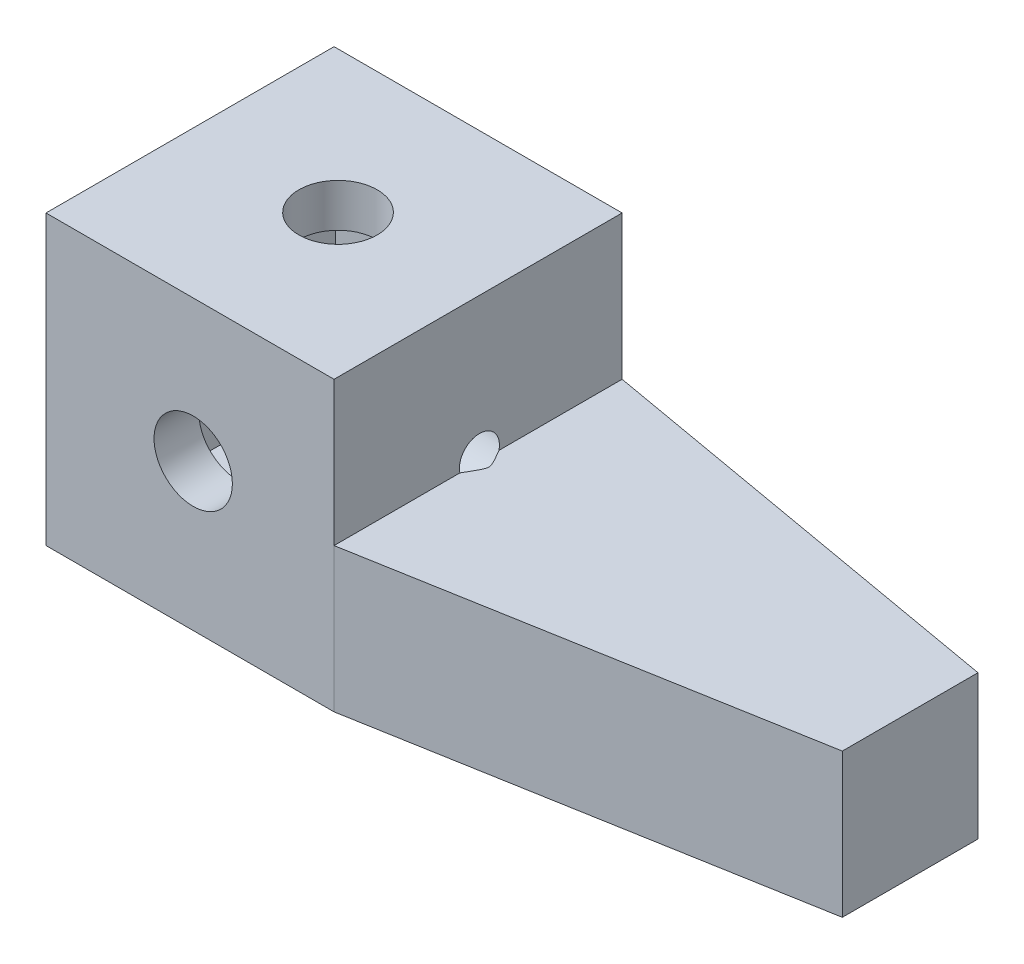
from build123d import *

# Parameters (mm, degrees)
BOSS_EXTRUDE1_DEPTH       = 6.35
SKETCH2_W                 = 12.7
SKETCH2_H                 = 12.7
BOSS_EXTRUDE2_DEPTH       = 12.7
CUT_EXTRUDE1_DEPTH        = 4.445
CUT_EXTRUDE1_DEPTH_BACK   = 4.445
CUT_EXTRUDE1_START        = 6.35
SKETCH3_W                 = 8.89
SKETCH3_H                 = 8.89
F_8_32_TAPPED_HOLE1_D     = 3.4544
F_8_32_TAPPED_HOLE1_DEPTH = 12.28344
F_8_32_TAPPED_HOLE1_TIP   = 1.037806461
F_8_32_TAPPED_HOLE2_D     = 3.4544
F_8_32_TAPPED_HOLE2_DEPTH = 12.192
F_8_32_TAPPED_HOLE2_TIP   = 1.037806461
F_8_32_TAPPED_HOLE3_D     = 3.4544
F_8_32_TAPPED_HOLE3_DEPTH = 12.192
F_8_32_TAPPED_HOLE3_TIP   = 1.037806461
F_8_32_TAPPED_HOLE4_D     = 3.4544
F_8_32_TAPPED_HOLE4_DEPTH = 12.192
F_8_32_TAPPED_HOLE4_TIP   = 1.037806461


with BuildPart() as part:
    # Sketch1 → Boss-Extrude1 (new body)
    with BuildSketch(Plane(origin=(0, 0, 0), x_dir=(1, 0, 0), z_dir=(0, 1, 0))):
        Polygon((0, 0), (19.05, 3.359028982), (19.05, 9.340971018), (0, 12.7), align=None)
    extrude(amount=BOSS_EXTRUDE1_DEPTH)

    # Sketch2 → Boss-Extrude2 (add)
    with BuildSketch(Plane(origin=(0, 0, 0), x_dir=(1, 0, 0), z_dir=(0, 1, 0))):
        with Locations((-6.35, 6.35)):
            Rectangle(SKETCH2_W, SKETCH2_H)
    extrude(amount=BOSS_EXTRUDE2_DEPTH)

    # Sketch3 → Cut-Extrude1 (cut, two sides: drawn at the far end of the back side and taken through both)
    with BuildSketch(Plane(origin=(0, 0, 0), x_dir=(1, 0, 0), z_dir=(0, 1, 0)).offset(CUT_EXTRUDE1_START - CUT_EXTRUDE1_DEPTH_BACK)):
        with Locations((-6.35, 6.421317362)):
            Rectangle(SKETCH3_W, SKETCH3_H)
    extrude(amount=CUT_EXTRUDE1_DEPTH + CUT_EXTRUDE1_DEPTH_BACK, mode=Mode.SUBTRACT)

    # #8-32 Tapped Hole1
    with Locations(Plane.XY):
        with Locations((-6.210106544, 6.467962425), (-17.791429467, 4.563139576)):
            Hole(F_8_32_TAPPED_HOLE1_D / 2, depth=F_8_32_TAPPED_HOLE1_DEPTH)
            with Locations((0, 0, -(F_8_32_TAPPED_HOLE1_DEPTH + F_8_32_TAPPED_HOLE1_TIP / 2))):  # 118° drill point
                Cone(0, F_8_32_TAPPED_HOLE1_D / 2, F_8_32_TAPPED_HOLE1_TIP, mode=Mode.SUBTRACT)

    # #8-32 Tapped Hole2
    with Locations(Plane(origin=(0, 0, -12.7), x_dir=(-1, 0, 0), z_dir=(0, 0, -1))):
        with Locations((6.210106544, 6.467962425)):
            Hole(F_8_32_TAPPED_HOLE2_D / 2, depth=F_8_32_TAPPED_HOLE2_DEPTH)
            with Locations((0, 0, -(F_8_32_TAPPED_HOLE2_DEPTH + F_8_32_TAPPED_HOLE2_TIP / 2))):  # 118° drill point
                Cone(0, F_8_32_TAPPED_HOLE2_D / 2, F_8_32_TAPPED_HOLE2_TIP, mode=Mode.SUBTRACT)

    # #8-32 Tapped Hole3
    with Locations(Plane(origin=(0, 12.7, 0), x_dir=(1, 0, 0), z_dir=(0, 1, 0))):
        with Locations((-6.284915842, 6.460616317)):
            Hole(F_8_32_TAPPED_HOLE3_D / 2, depth=F_8_32_TAPPED_HOLE3_DEPTH)
            with Locations((0, 0, -(F_8_32_TAPPED_HOLE3_DEPTH + F_8_32_TAPPED_HOLE3_TIP / 2))):  # 118° drill point
                Cone(0, F_8_32_TAPPED_HOLE3_D / 2, F_8_32_TAPPED_HOLE3_TIP, mode=Mode.SUBTRACT)

    # #8-32 Tapped Hole4
    with Locations(Plane.ZY.offset(12.7)):
        with Locations((-6.409821041, 6.541174093)):
            Hole(F_8_32_TAPPED_HOLE4_D / 2, depth=F_8_32_TAPPED_HOLE4_DEPTH)
            with Locations((0, 0, -(F_8_32_TAPPED_HOLE4_DEPTH + F_8_32_TAPPED_HOLE4_TIP / 2))):  # 118° drill point
                Cone(0, F_8_32_TAPPED_HOLE4_D / 2, F_8_32_TAPPED_HOLE4_TIP, mode=Mode.SUBTRACT)


solid = part.part
